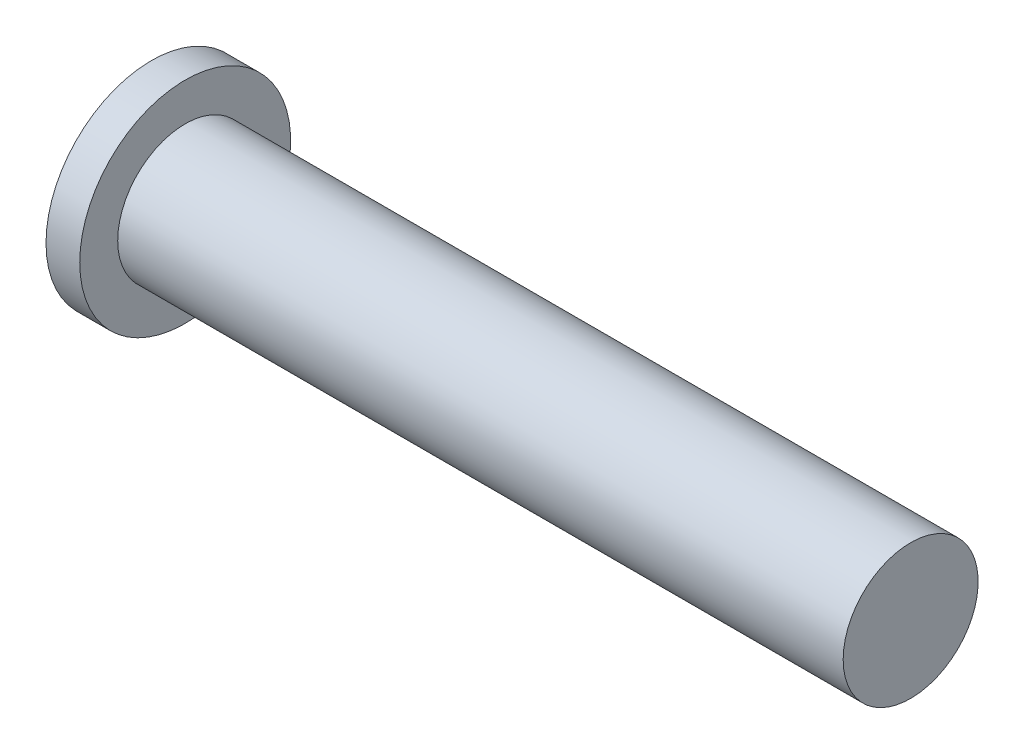
from build123d import *


with BuildPart() as part:
    # ｽｹｯﾁ1 → 回転1 (revolve)
    with BuildSketch(Plane(origin=(0, 0, 0), x_dir=(1, 0, 0), z_dir=(0, 1, 0)), mode=Mode.PRIVATE) as revolve_1_sk:
        Polygon((0, 0), (0, 6.25), (2, 6.25), (2, 4), (45, 4), (45, 0), align=None)
    revolve(revolve_1_sk.sketch.rotate(Axis((0, 0, 0), (1, 0, 0)), 180), axis=Axis((0, 0, 0), (1, 0, 0)))


solid = part.part
